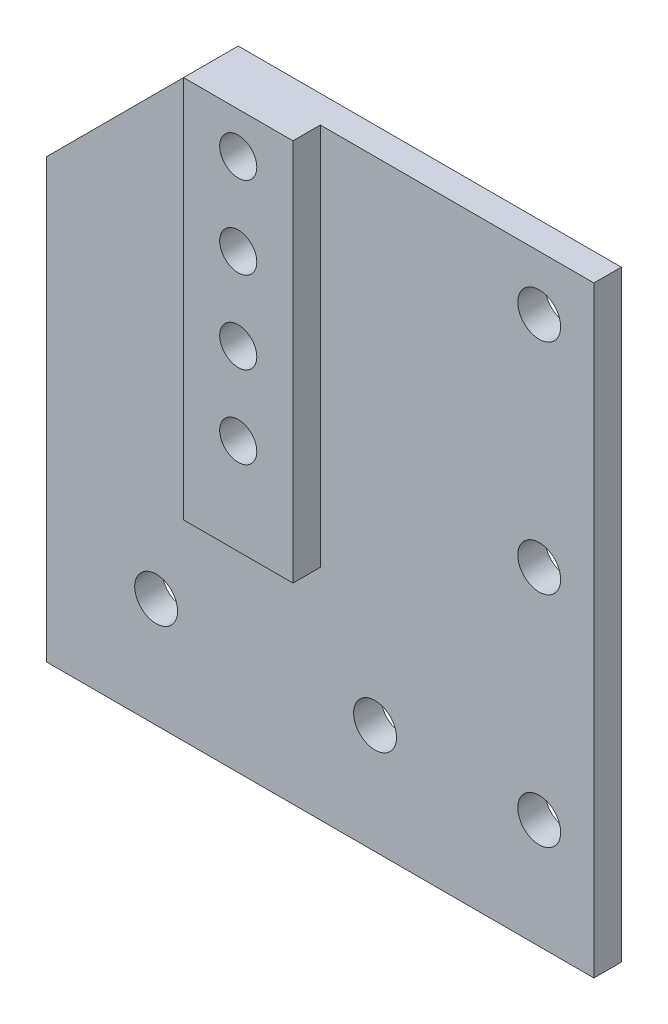
from build123d import *

# Parameters (mm, degrees)
BOSS_EXTRUDE1_DEPTH    = 3.175
F_10_CLEARANCE_HOLE1_D = 4.9784
SKETCH5_W              = 12.7
SKETCH5_H              = 44.45
BOSS_EXTRUDE2_DEPTH    = 3.175
F_8_CLEARANCE_HOLE1_D  = 4.3053


with BuildPart() as part:
    # Sketch1 → Boss-Extrude1 (new body)
    with BuildSketch(Plane.XY):
        Polygon((-266.700000508, -12.7), (-266.700000508, 57.15), (-279.400000508, 57.15), (-311.150000508, 57.15), (-330.200000508, 38.1), (-330.200000508, 12.7), (-330.200000508, -12.7), (-279.400000508, -12.7), align=None)
    extrude(amount=BOSS_EXTRUDE1_DEPTH)

    # #10 Clearance Hole1 (through all)
    with Locations(Plane.XY.offset(3.175)):
        with Locations((-273.050000508, 50.8), (-273.050000508, 25.4), (-273.050000508, 0), (-317.500000508, 0), (-292.100000508, 0)):
            Hole(F_10_CLEARANCE_HOLE1_D / 2)

    # Sketch5 → Boss-Extrude2 (add)
    with BuildSketch(Plane.XY.offset(3.175)):
        with Locations((-304.800000508, 34.925)):
            Rectangle(SKETCH5_W, SKETCH5_H)
    extrude(amount=BOSS_EXTRUDE2_DEPTH)

    # #8 Clearance Hole1 (through all)
    with Locations(Plane.XY.offset(6.35)):
        with Locations((-304.800000508, 42.8625), (-304.800000508, 52.3875), (-304.800000508, 33.3375), (-304.800000508, 23.8125)):
            Hole(F_8_CLEARANCE_HOLE1_D / 2)


solid = part.part
